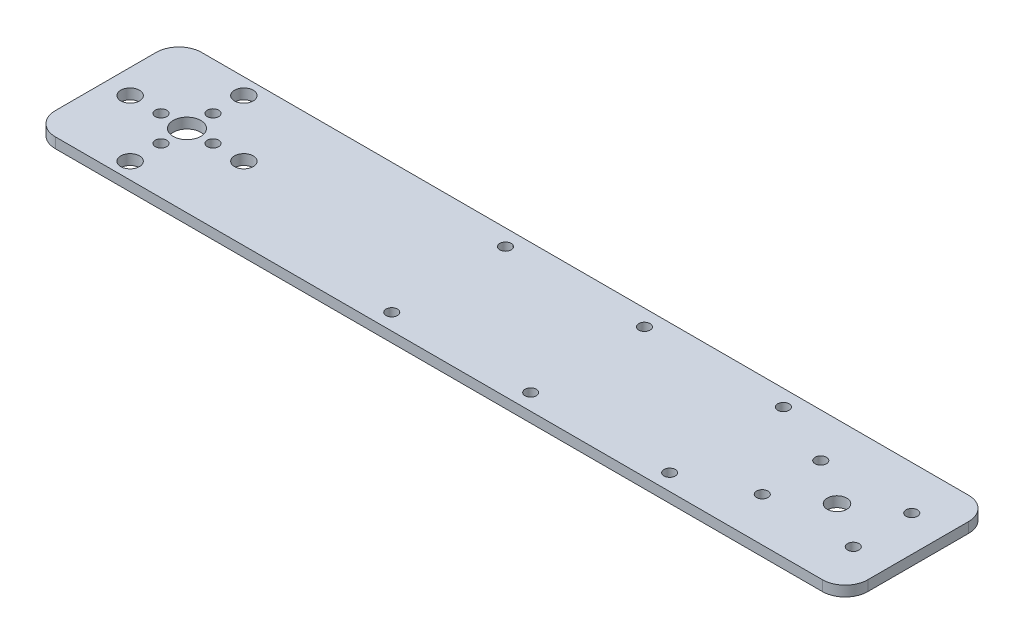
from build123d import *

# Parameters (mm, degrees)
SKETCH1_W           = 250
SKETCH1_H           = 45
BOSS_EXTRUDE1_DEPTH = 3.175
SKETCH4_R           = 3
SKETCH4_R_2         = 1.75
CUT_EXTRUDE1_DEPTH  = 227.144490592
SKETCH5_R           = 4.25
CUT_EXTRUDE2_DEPTH  = 227.144490592
SKETCH10_R          = 1.75
CUT_EXTRUDE4_DEPTH  = 227.144490592
FILLET1_R           = 7
SKETCH11_R          = 2.875
CUT_EXTRUDE5_DEPTH  = 227.144490592
SKETCH12_R          = 1.75
CUT_EXTRUDE6_DEPTH  = 227.144490592


with BuildPart() as part:
    # Sketch1 → Boss-Extrude1 (new body)
    with BuildSketch(Plane(origin=(0, 0, 0), x_dir=(1, 0, 0), z_dir=(0, 1, 0))):
        with Locations((100, 0)):
            Rectangle(SKETCH1_W, SKETCH1_H)
    extrude(amount=BOSS_EXTRUDE1_DEPTH)

    # Sketch4 → Cut-Extrude1 (cut, through all)
    with BuildSketch(Plane(origin=(0, 3.175, 0), x_dir=(1, 0, 0), z_dir=(0, 1, 0))):
        with Locations(Location((200, 0, 0), (0, 0, 270))):
            Circle(SKETCH4_R)
        with Locations(Location((186, 9, 0), (0, 0, 270))):
            Circle(SKETCH4_R_2)
        with Locations(Location((214, 9, 0), (0, 0, 90))):
            Circle(SKETCH4_R_2)
        with Locations(Location((214, -9, 0), (0, 0, 270))):
            Circle(SKETCH4_R_2)
        with Locations(Location((186, -9, 0), (0, 0, 90))):
            Circle(SKETCH4_R_2)
    extrude(amount=-CUT_EXTRUDE1_DEPTH, mode=Mode.SUBTRACT)

    # Sketch5 → Cut-Extrude2 (cut, through all)
    with BuildSketch(Plane(origin=(0, 3.175, 0), x_dir=(1, 0, 0), z_dir=(0, 1, 0))):
        with Locations(Location((0, 0, 0), (0, 0, 270))):
            Circle(SKETCH5_R)
    extrude(amount=-CUT_EXTRUDE2_DEPTH, mode=Mode.SUBTRACT)

    # Sketch10 → Cut-Extrude4 (cut, through all)
    with BuildSketch(Plane(origin=(0, 3.175, 0), x_dir=(1, 0, 0), z_dir=(0, 1, 0))):
        with Locations(Location((80.5, -17.5, 0), (0, 0, 270))):
            Circle(SKETCH10_R)
        with Locations(Location((166, -17.5, 0), (0, 0, 270))):
            Circle(SKETCH10_R)
        with Locations(Location((166, 17.5, 0), (0, 0, 90))):
            Circle(SKETCH10_R)
        with Locations(Location((80.5, 17.5, 0), (0, 0, 90))):
            Circle(SKETCH10_R)
        with Locations(Location((123.25, -17.5, 0), (0, 0, 270))):
            Circle(SKETCH10_R)
        with Locations(Location((123.25, 17.5, 0), (0, 0, 90))):
            Circle(SKETCH10_R)
    extrude(amount=-CUT_EXTRUDE4_DEPTH, mode=Mode.SUBTRACT)

    # Fillet1
    fillet1_edges = [part.edges().sort_by_distance(p)[0] for p in [
        (-25, 1.5875, -22.5),
        (225, 1.5875, -22.5),
        (225, 1.5875, 22.5),
        (-25, 1.5875, 22.5),
    ]]
    fillet(fillet1_edges, radius=FILLET1_R)

    # Sketch11 → Cut-Extrude5 (cut, through all)
    with BuildSketch(Plane(origin=(0, 3.175, 0), x_dir=(1, 0, 0), z_dir=(0, 1, 0))):
        with Locations(Location((0, 17.5, 0), (0, 0, 270))):
            Circle(SKETCH11_R)
        with Locations(Location((17.5, 0, 0), (0, 0, 270))):
            Circle(SKETCH11_R)
        with Locations(Location((0, -17.5, 0), (0, 0, 270))):
            Circle(SKETCH11_R)
        with Locations(Location((-17.5, 0, 0), (0, 0, 270))):
            Circle(SKETCH11_R)
    extrude(amount=-CUT_EXTRUDE5_DEPTH, mode=Mode.SUBTRACT)

    # Sketch12 → Cut-Extrude6 (cut, through all)
    with BuildSketch(Plane(origin=(0, 3.175, 0), x_dir=(1, 0, 0), z_dir=(0, 1, 0))):
        with Locations(Location((0, 8, 0), (0, 0, 270))):
            Circle(SKETCH12_R)
        with Locations(Location((8, 0, 0), (0, 0, 270))):
            Circle(SKETCH12_R)
        with Locations(Location((0, -8, 0), (0, 0, 270))):
            Circle(SKETCH12_R)
        with Locations(Location((-8, 0, 0), (0, 0, 270))):
            Circle(SKETCH12_R)
    extrude(amount=-CUT_EXTRUDE6_DEPTH, mode=Mode.SUBTRACT)


solid = part.part
